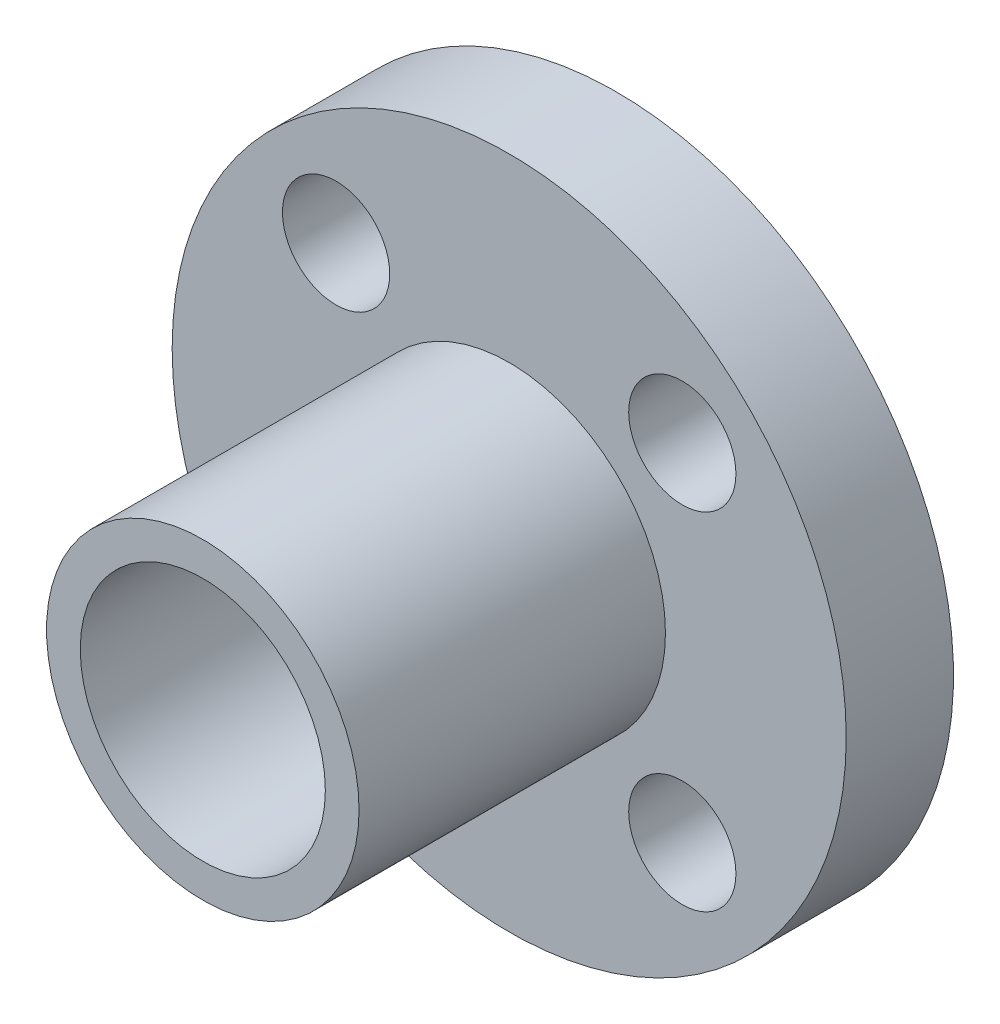
from build123d import *

# Parameters (mm, degrees)
SKETCH1_R           = 11
BOSS_EXTRUDE1_DEPTH = 15
SKETCH2_OUTSIDE_W   = 30.908
SKETCH2_OUTSIDE_H   = 30.908
SKETCH2_OUTSIDE_R   = 5.1
CUT_EXTRUDE1_DEPTH  = 10
SKETCH3_OUTSIDE_W   = 30.908
SKETCH3_OUTSIDE_H   = 30.908
SKETCH3_OUTSIDE_R   = 5.1
CUT_EXTRUDE2_DEPTH  = 1.5
SKETCH8_R           = 1.75
CUT_EXTRUDE3_DEPTH  = 21.597329924
SKETCH9_R           = 4
CUT_EXTRUDE4_DEPTH  = 22.610182785


with BuildPart() as part:
    # Sketch1 → Boss-Extrude1 (new body)
    with BuildSketch(Plane.XY):
        Circle(SKETCH1_R)
    extrude(amount=BOSS_EXTRUDE1_DEPTH)

    # Sketch2 outside → Cut-Extrude1 (cut)
    with BuildSketch(Plane.XY.offset(15)):
        Rectangle(SKETCH2_OUTSIDE_W, SKETCH2_OUTSIDE_H)
        Circle(SKETCH2_OUTSIDE_R, mode=Mode.SUBTRACT)
    extrude(amount=-CUT_EXTRUDE1_DEPTH, mode=Mode.SUBTRACT)

    # Sketch3 outside → Cut-Extrude2 (cut)
    with BuildSketch(Plane(origin=(0, 0, 0), x_dir=(-1, 0, 0), z_dir=(0, 0, -1))):
        Rectangle(SKETCH3_OUTSIDE_W, SKETCH3_OUTSIDE_H)
        with Locations(Location((0, 0, 0), (0, 0, 180))):
            Circle(SKETCH3_OUTSIDE_R, mode=Mode.SUBTRACT)
    extrude(amount=-CUT_EXTRUDE2_DEPTH, mode=Mode.SUBTRACT)

    # Sketch8 → Cut-Extrude3 (cut, through all)
    with BuildSketch(Plane(origin=(0, 0, 1.5), x_dir=(-1, 0, 0), z_dir=(0, 0, -1))):
        with Locations((-5.65, -5.65)):
            Circle(SKETCH8_R)
        with Locations((-5.65, 5.65)):
            Circle(SKETCH8_R)
        with Locations((5.65, 5.65)):
            Circle(SKETCH8_R)
        with Locations((5.65, -5.65)):
            Circle(SKETCH8_R)
    extrude(amount=-CUT_EXTRUDE3_DEPTH, mode=Mode.SUBTRACT)

    # Sketch9 → Cut-Extrude4 (cut, through all)
    with BuildSketch(Plane(origin=(0, 0, 0), x_dir=(-1, 0, 0), z_dir=(0, 0, -1))):
        Circle(SKETCH9_R)
    extrude(amount=-CUT_EXTRUDE4_DEPTH, mode=Mode.SUBTRACT)


solid = part.part
